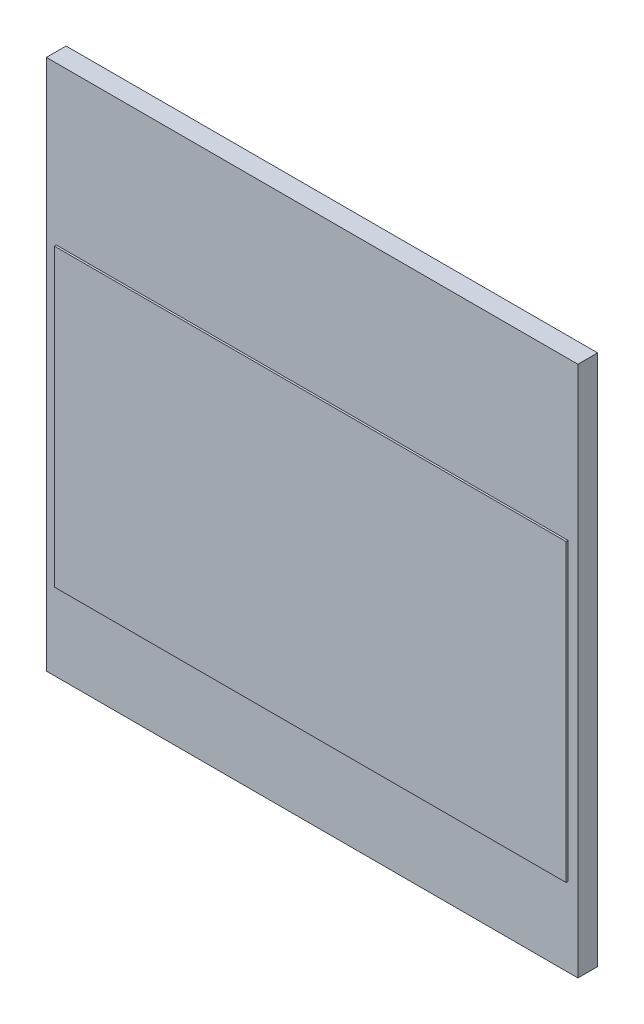
from build123d import *

# Parameters (mm, degrees)
SKETCH1_W           = 26
SKETCH1_H           = 15
BOSS_EXTRUDE1_DEPTH = 0.1
SKETCH2_W           = 27
SKETCH2_H           = 27
BOSS_EXTRUDE2_DEPTH = 1


with BuildPart() as part:
    # Sketch1 → Boss-Extrude1 (new body)
    with BuildSketch(Plane.XY):
        Rectangle(SKETCH1_W, SKETCH1_H)
    extrude(amount=BOSS_EXTRUDE1_DEPTH)

    # Sketch2 → Boss-Extrude2 (add)
    with BuildSketch(Plane(origin=(0, 0, 0), x_dir=(-1, 0, 0), z_dir=(0, 0, -1))):
        with Locations((0, 2)):
            Rectangle(SKETCH2_W, SKETCH2_H)
    extrude(amount=BOSS_EXTRUDE2_DEPTH)


solid = part.part
